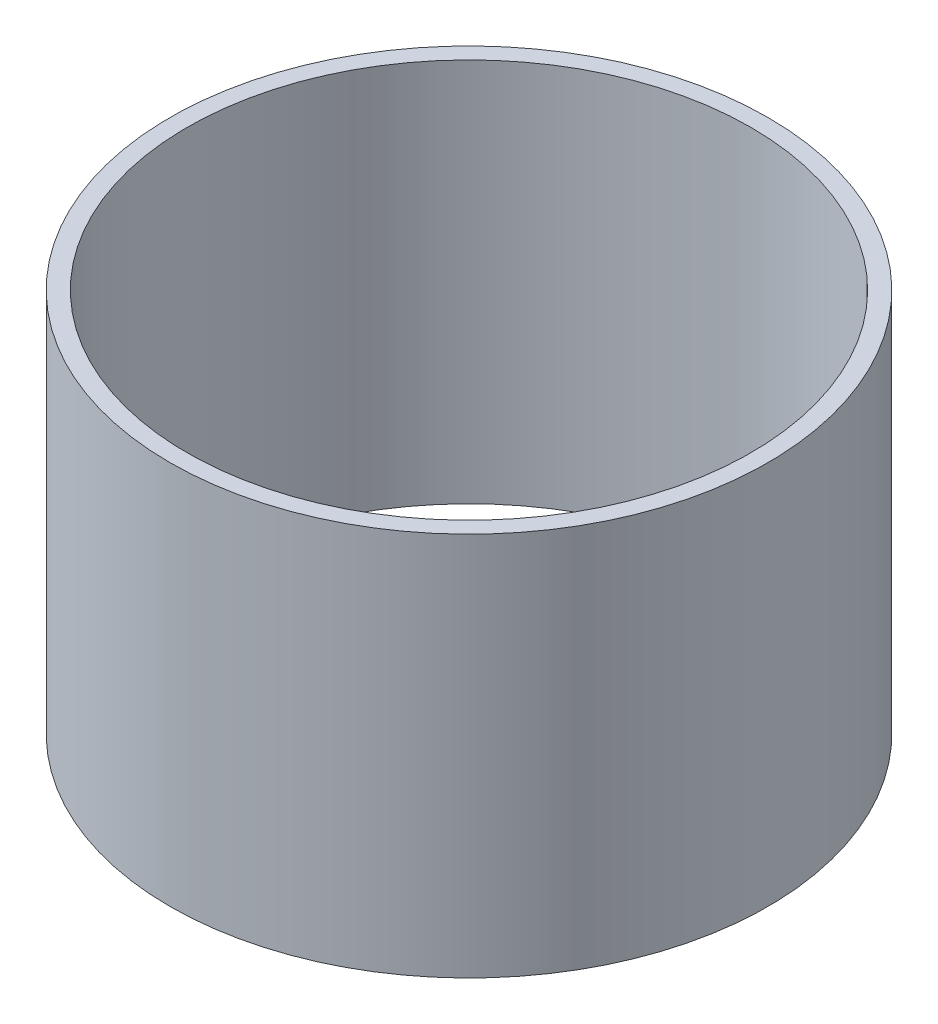
from build123d import *

# Parameters (mm, degrees)
SKETCH1_R           = 70
SKETCH1_R_2         = 66
BOSS_EXTRUDE1_DEPTH = 90


with BuildPart() as part:
    # Sketch1 → Boss-Extrude1 (new body)
    with BuildSketch(Plane(origin=(0, 0, 0), x_dir=(1, 0, 0), z_dir=(0, 1, 0))):
        with Locations(Location((0, 0, 0), (0, 0, 90))):
            Circle(SKETCH1_R)
        with Locations(Location((0, 0, 0), (0, 0, 90))):
            Circle(SKETCH1_R_2, mode=Mode.SUBTRACT)
    extrude(amount=BOSS_EXTRUDE1_DEPTH)


solid = part.part
